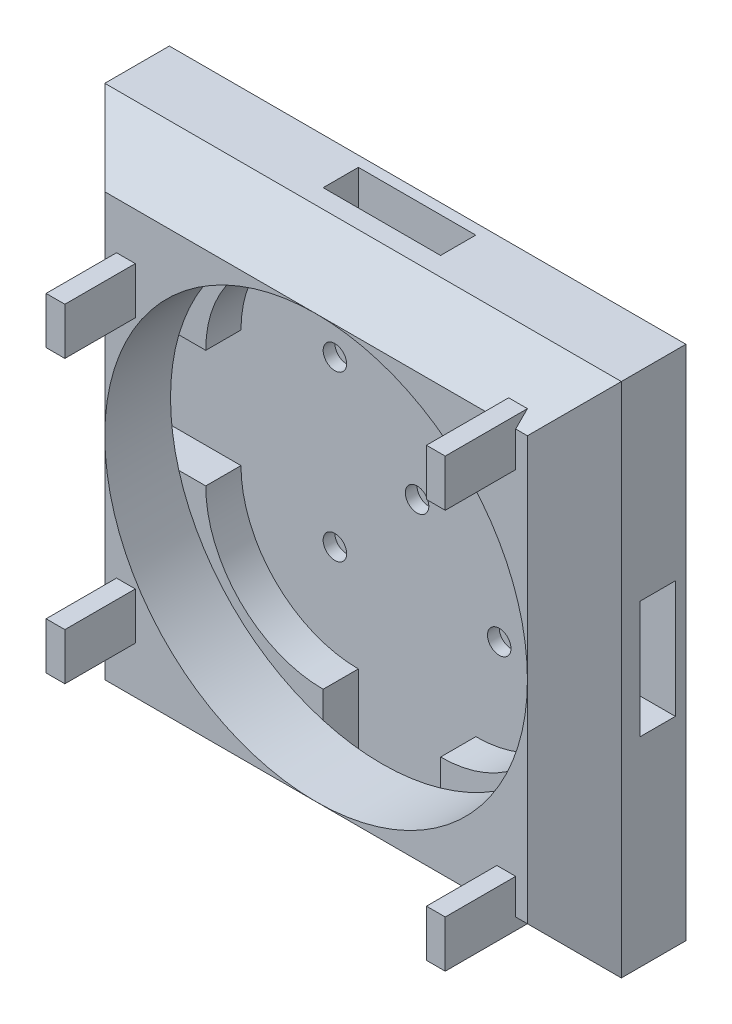
from build123d import *

# Parameters (mm, degrees)
SKETCH_1_W                  = 220
SKETCH_1_H                  = 220
EXTRUDE_1_DEPTH             = 20
EXTRUDE_1_TAPER             = 45
SKETCH_2_W                  = 8
SKETCH_2_H                  = 20
EXTRUDE_2_DEPTH             = 30
EXTRUDE_2_DIRECTION_2_REACH = 158.844
SKETCH_4_W                  = 220
SKETCH_4_H                  = 220
EXTRUDE_3_DEPTH             = 30
CUT_EXTRUDE_1_DEPTH         = 15
SKETCH_7_R                  = 90
CUT_EXTRUDE_2_DEPTH         = 28
SKETCH_9_R                  = 5
CUT_EXTRUDE_3_DEPTH         = 5
CUT_EXTRUDE_4_DEPTH         = 251.99800796
PATTERN_CIRCULAR_2_COUNT    = 4


with BuildPart() as part:
    # 스케치1 → 보스-돌출1 (new body)
    with BuildSketch(Plane.XY):
        Rectangle(SKETCH_1_W, SKETCH_1_H)
    extrude(amount=EXTRUDE_1_DEPTH, taper=EXTRUDE_1_TAPER)

    # 스케치2 → 보스-돌출2 (add)
    with BuildSketch(Plane.XY.offset(20)):
        with Locations((-81, 60)):
            Rectangle(SKETCH_2_W, SKETCH_2_H)
        with Locations((-81, -60)):
            Rectangle(SKETCH_2_W, SKETCH_2_H)
        with Locations((81, 85)):
            Rectangle(SKETCH_2_W, SKETCH_2_H)
        with Locations((81, -85)):
            Rectangle(SKETCH_2_W, SKETCH_2_H)
    extrude(amount=EXTRUDE_2_DEPTH)

    # 보스-돌출2 direction 2: up to this face of the body (flat: up to its plane)
    extrude_2_direction_2_end = Plane(part.part.faces().sort_by_distance((0, 0, 0))[0])
    # 스케치2 → 보스-돌출2 direction 2 (add, up to the picked face)
    with BuildSketch(Plane.XY.offset(20), mode=Mode.PRIVATE) as extrude_2_direction_2_sk1:
        with Locations((-81, 60)):
            Rectangle(SKETCH_2_W, SKETCH_2_H)
    extrude_2_direction_2_tool1 = split(extrude(extrude_2_direction_2_sk1.sketch, amount=-EXTRUDE_2_DIRECTION_2_REACH, mode=Mode.PRIVATE), bisect_by=extrude_2_direction_2_end, keep=Keep.BOTH, mode=Mode.PRIVATE)
    # 스케치2 → 보스-돌출2 direction 2 (add, up to the picked face)
    with BuildSketch(Plane.XY.offset(20), mode=Mode.PRIVATE) as extrude_2_direction_2_sk2:
        with Locations((-81, -60)):
            Rectangle(SKETCH_2_W, SKETCH_2_H)
    extrude_2_direction_2_tool2 = split(extrude(extrude_2_direction_2_sk2.sketch, amount=-EXTRUDE_2_DIRECTION_2_REACH, mode=Mode.PRIVATE), bisect_by=extrude_2_direction_2_end, keep=Keep.BOTH, mode=Mode.PRIVATE)
    # 스케치2 → 보스-돌출2 direction 2 (add, up to the picked face)
    with BuildSketch(Plane.XY.offset(20), mode=Mode.PRIVATE) as extrude_2_direction_2_sk3:
        with Locations((81, 85)):
            Rectangle(SKETCH_2_W, SKETCH_2_H)
    extrude_2_direction_2_tool3 = split(extrude(extrude_2_direction_2_sk3.sketch, amount=-EXTRUDE_2_DIRECTION_2_REACH, mode=Mode.PRIVATE), bisect_by=extrude_2_direction_2_end, keep=Keep.BOTH, mode=Mode.PRIVATE)
    # 스케치2 → 보스-돌출2 direction 2 (add, up to the picked face)
    with BuildSketch(Plane.XY.offset(20), mode=Mode.PRIVATE) as extrude_2_direction_2_sk4:
        with Locations((81, -85)):
            Rectangle(SKETCH_2_W, SKETCH_2_H)
    extrude_2_direction_2_tool4 = split(extrude(extrude_2_direction_2_sk4.sketch, amount=-EXTRUDE_2_DIRECTION_2_REACH, mode=Mode.PRIVATE), bisect_by=extrude_2_direction_2_end, keep=Keep.BOTH, mode=Mode.PRIVATE)
    add(extrude_2_direction_2_tool1.solids().sort_by(Axis((-81, 60, 20), (0, 0, -1)))[0])
    add(extrude_2_direction_2_tool2.solids().sort_by(Axis((-81, -60, 20), (0, 0, -1)))[0])
    add(extrude_2_direction_2_tool3.solids().sort_by(Axis((81, 85, 20), (0, 0, -1)))[0])
    add(extrude_2_direction_2_tool4.solids().sort_by(Axis((81, -85, 20), (0, 0, -1)))[0])

    # 스케치4 → 보스-돌출3 (add)
    with BuildSketch(Plane(origin=(0, 0, 0), x_dir=(-1, 0, 0), z_dir=(0, 0, -1))):
        Rectangle(SKETCH_4_W, SKETCH_4_H)
    extrude(amount=EXTRUDE_3_DEPTH)

    # 스케치6 → 컷-돌출1 (cut)
    with BuildSketch(Plane(origin=(0, 0, -23), x_dir=(-1, 0, 0), z_dir=(0, 0, -1))):
        with BuildLine():
            Line((-110, 25), (-75, 25))
            ThreePointArc((-75, 25), (-60.355339059, 60.355339059), (-25, 75))
            Line((-25, 75), (-25, 110))
            Line((-25, 110), (25, 110))
            Line((25, 110), (25, 75))
            ThreePointArc((25, 75), (60.355339059, 60.355339059), (75, 25))
            Line((75, 25), (110, 25))
            Line((110, 25), (110, -25))
            Line((110, -25), (75, -25))
            ThreePointArc((75, -25), (60.355339059, -60.355339059), (25, -75))
            Line((25, -75), (25, -110))
            Line((25, -110), (-25, -110))
            Line((-25, -110), (-25, -75))
            ThreePointArc((-25, -75), (-60.355339059, -60.355339059), (-75, -25))
            Line((-75, -25), (-110, -25))
            Line((-110, -25), (-110, 25))
        make_face()
    extrude(amount=-CUT_EXTRUDE_1_DEPTH, mode=Mode.SUBTRACT)

    # 스케치7 → 컷-돌출2 (cut)
    with BuildSketch(Plane.XY.offset(20)):
        Circle(SKETCH_7_R)
    extrude(amount=-CUT_EXTRUDE_2_DEPTH, mode=Mode.SUBTRACT)

    # 스케치9 → 컷-돌출3 (cut)
    with BuildSketch(Plane.XY.offset(-23)):
        with Locations((-35, 35)):
            Circle(SKETCH_9_R)
        Circle(SKETCH_9_R)
        with Locations((35, 35)):
            Circle(SKETCH_9_R)
        with Locations(Location((35, -35, 0), (0, 0, 180))):
            Circle(SKETCH_9_R)
        with Locations(Location((-35, -35, 0), (0, 0, 180))):
            Circle(SKETCH_9_R)
    extrude(amount=-CUT_EXTRUDE_3_DEPTH, mode=Mode.SUBTRACT)

    # 스케치10 → 컷-돌출4 (cut, through all)
    with BuildSketch(Plane(origin=(0, 110, 0), x_dir=(1, 0, 0), z_dir=(0, 1, 0))):
        Polygon((-110, 30), (-110, 27.5), (-107.5, 30), align=None)
    cut_extrude_4 = extrude(amount=-CUT_EXTRUDE_4_DEPTH, mode=Mode.SUBTRACT)

    # 원형 패턴2: 컷-돌출4 ×4 about axis
    pattern_circular_2_axis = Axis((0, 0, 0), (0, 0, 1))
    for i in range(1, PATTERN_CIRCULAR_2_COUNT):
        add(cut_extrude_4.rotate(pattern_circular_2_axis, i * 360 / PATTERN_CIRCULAR_2_COUNT), mode=Mode.SUBTRACT)


solid = part.part
